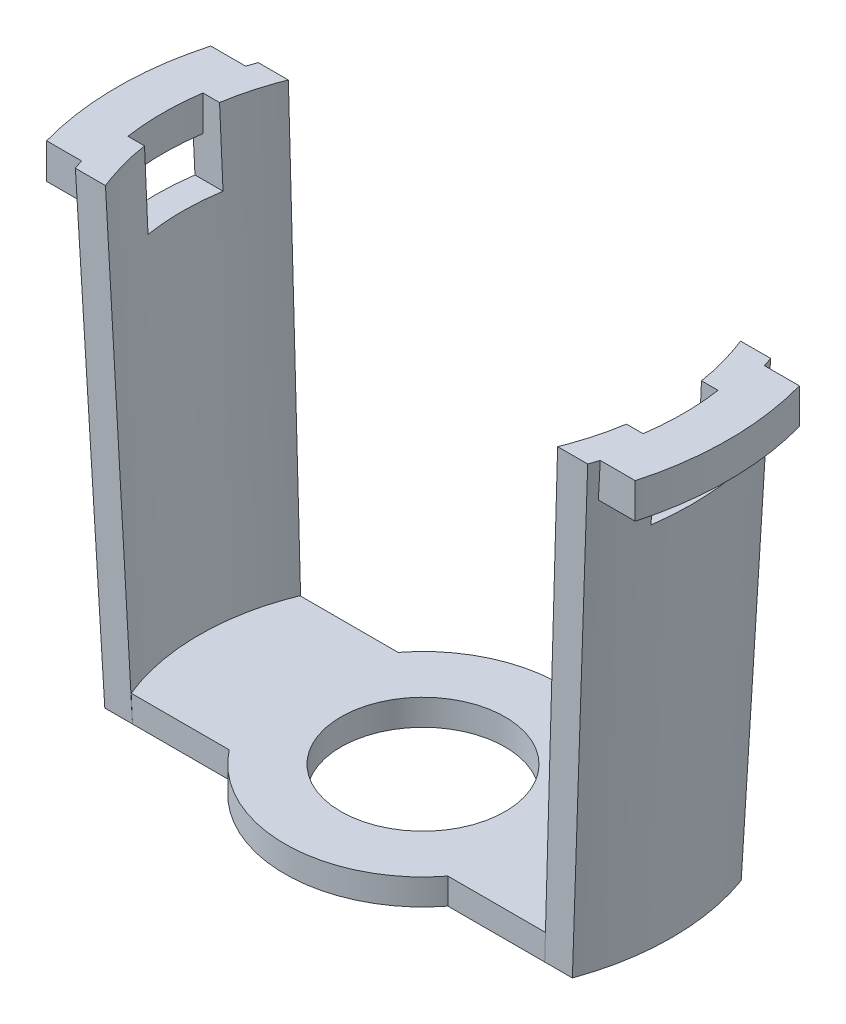
from build123d import *

# Parameters (mm, degrees)
SKETCH1_R                 = 4.445
BASE_DEPTH                = 1.4097
RADIAL_FLANGE_DEPTH       = 1.905
AXIAL_CUT_OUT_DEPTH       = 4.064
RADIAL_CUT_OUT_DEPTH      = 31.822696079
RADIAL_CUT_OUT_DEPTH_BACK = 31.822696079
SKETCH6_W                 = 4.064
SKETCH6_H                 = 2.159


with BuildPart() as part:
    # Sketch1 → Base (new body)
    with BuildSketch(Plane(origin=(0, 0, 0), x_dir=(1, 0, 0), z_dir=(0, 1, 0))):
        with BuildLine():
            Line((-12.661842678, 4.572), (-5.920447964, 4.572))
            ThreePointArc((-5.920447964, 4.572), (0, 7.4803), (5.920447964, 4.572))
            Line((5.920447964, 4.572), (12.661842678, 4.572))
            ThreePointArc((12.661842678, 4.572), (13.462, 0), (12.661842678, -4.572))
            Line((12.661842678, -4.572), (5.920447964, -4.572))
            ThreePointArc((5.920447964, -4.572), (0, -7.4803), (-5.920447964, -4.572))
            Line((-5.920447964, -4.572), (-12.661842678, -4.572))
            ThreePointArc((-12.661842678, -4.572), (-13.462, 0), (-12.661842678, 4.572))
        make_face()
        with Locations(Location((0, 0, 0), (0, 0, 270))):
            Circle(SKETCH1_R, mode=Mode.SUBTRACT)
    extrude(amount=BASE_DEPTH)

    # Sketch3 for Arm loft → Arm loft section 0
    with BuildSketch(Plane(origin=(0, 0, 0), x_dir=(1, 0, 0), z_dir=(0, 1, 0))):
        with BuildLine():
            Line((-12.661842678, -4.572), (-11.163242678, -4.572))
            # circular arc as an exact rational Bezier (weights 1, cos(half-angle), 1)
            Bezier((-11.163242678, -4.572), (-13.035743761, 0), (-11.163242678, 4.572), weights=[1, 0.92539527, 1])
            Line((-11.163242678, 4.572), (-12.661842678, 4.572))
            Bezier((-12.661842678, 4.572), (-14.31272277, 0), (-12.661842678, -4.572), weights=[1, 0.94056178, 1])
        make_face()
    # Sketch2 for Arm loft → Arm loft section 1
    with BuildSketch(Plane(origin=(0, 24.9047, 0), x_dir=(-1, 0, 0), z_dir=(0, -1, 0))):
        with BuildLine():
            Line((12.244143702, 4.953), (13.874423051, 4.953))
            Bezier((13.874423051, 4.953), (15.64258371, 0), (13.874423051, -4.953), weights=[1, 0.941788152, 1])
            Line((13.874423051, -4.953), (12.244143702, -4.953))
            Bezier((12.244143702, -4.953), (14.247730853, 0), (12.244143702, 4.953), weights=[1, 0.927024811, 1])
        make_face()
    arm_loft = loft()

    # Mirror of arm loft: Arm loft across plane
    add(arm_loft.mirror(Plane(origin=(0, 0, 0), x_dir=(0, 0, 1), z_dir=(1, 0, 0))))

    # Sketch4 → Radial flange (add)
    with BuildSketch(Plane(origin=(0, 24.9047, 0), x_dir=(-1, 0, 0), z_dir=(0, -1, 0))):
        with BuildLine():
            Line((12.437573678, 4.445), (15.939936907, 4.445))
            ThreePointArc((15.939936907, 4.445), (16.5481, 0), (15.939936907, -4.445))
            Line((15.939936907, -4.445), (12.437573678, -4.445))
            ThreePointArc((12.437573678, -4.445), (13.208, 0), (12.437573678, 4.445))
        make_face()
    radial_flange = extrude(amount=RADIAL_FLANGE_DEPTH)

    # Sketch5 → Axial cut-out (cut)
    with BuildSketch(Plane(origin=(0, 24.9047, 0), x_dir=(1, 0, 0), z_dir=(0, 1, 0))):
        with BuildLine():
            Line((-11.247927631, 2.032), (-13.949780823, 2.032))
            ThreePointArc((-13.949780823, 2.032), (-14.097, 0), (-13.949780823, -2.032))
            Line((-13.949780823, -2.032), (-11.247927631, -2.032))
            ThreePointArc((-11.247927631, -2.032), (-11.43, 0), (-11.247927631, 2.032))
        make_face()
    axial_cut_out = extrude(amount=-AXIAL_CUT_OUT_DEPTH, mode=Mode.SUBTRACT)

    # Mirror of radial flange and axial cut-out: Radial flange, Axial cut-out across plane
    add(radial_flange.mirror(Plane(origin=(0, 0, 0), x_dir=(0, 0, 1), z_dir=(1, 0, 0))))
    add(axial_cut_out.mirror(Plane(origin=(0, 0, 0), x_dir=(0, 0, 1), z_dir=(1, 0, 0))), mode=Mode.SUBTRACT)

    # Sketch6 → Radial cut-out (cut, two sides: drawn at the far end of the back side and taken through both)
    with BuildSketch(Plane(origin=(0, 0, 0), x_dir=(0, 0, -1), z_dir=(1, 0, 0)).offset(-RADIAL_CUT_OUT_DEPTH_BACK)):
        with Locations((0, 21.9202)):
            Rectangle(SKETCH6_W, SKETCH6_H)
    extrude(amount=RADIAL_CUT_OUT_DEPTH + RADIAL_CUT_OUT_DEPTH_BACK, mode=Mode.SUBTRACT)


solid = part.part
